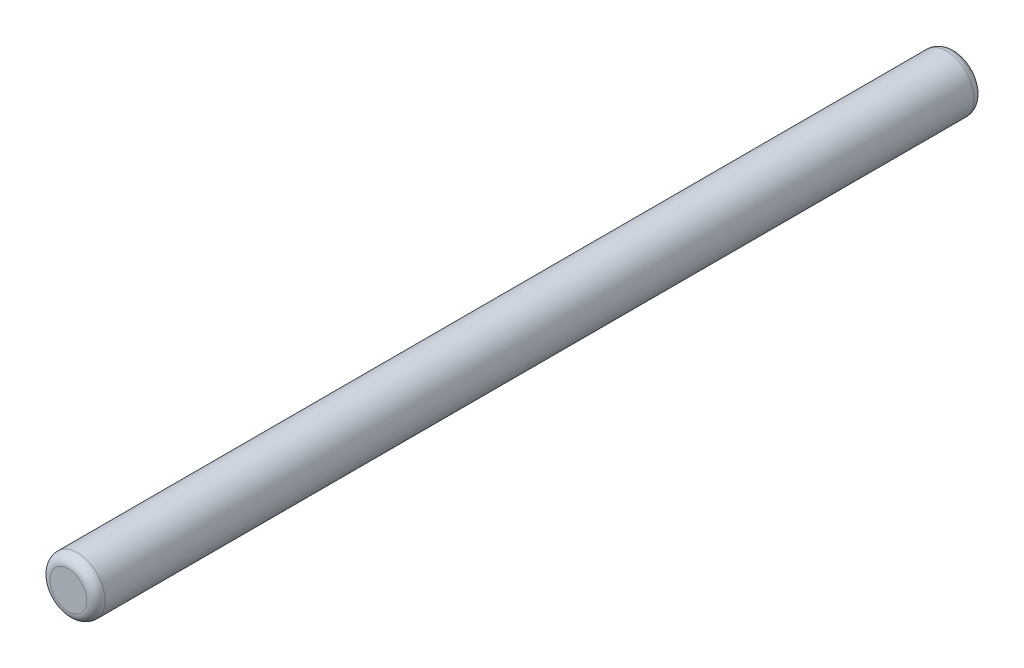
from build123d import *

# Parameters (mm, degrees)
ESQUISSE1_R      = 1.5
EXTRUSION1_DEPTH = 48
CONG_1_R         = 0.5


with BuildPart() as part:
    # Esquisse1 → Extrusion1 (new body)
    with BuildSketch(Plane.XY):
        Circle(ESQUISSE1_R)
    extrude(amount=EXTRUSION1_DEPTH)

    # Congé1
    cong_1_edges = [part.edges().sort_by_distance(p)[0] for p in [
        (-1.5, 0, 0),
        (-1.5, 0, 48),
    ]]
    fillet(cong_1_edges, radius=CONG_1_R)


solid = part.part
